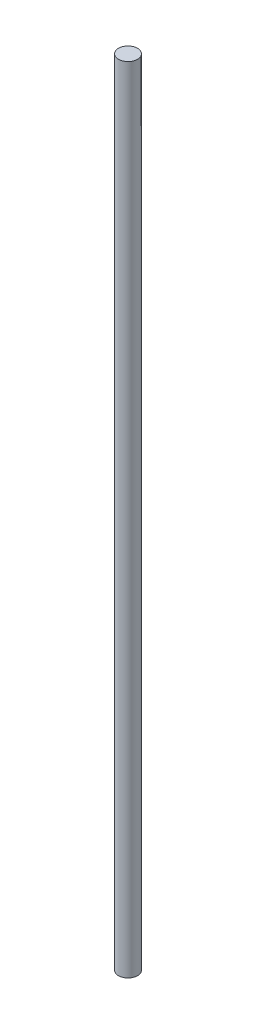
from build123d import *

# Parameters (mm, degrees)
SKETCH1_R           = 5
BOSS_EXTRUDE1_DEPTH = 416


with BuildPart() as part:
    # Sketch1 → Boss-Extrude1 (new body)
    with BuildSketch(Plane(origin=(0, 0, 0), x_dir=(1, 0, 0), z_dir=(0, 1, 0))):
        with Locations(Location((0, 0, 0), (0, 0, 90))):
            Circle(SKETCH1_R)
    extrude(amount=BOSS_EXTRUDE1_DEPTH)


solid = part.part
